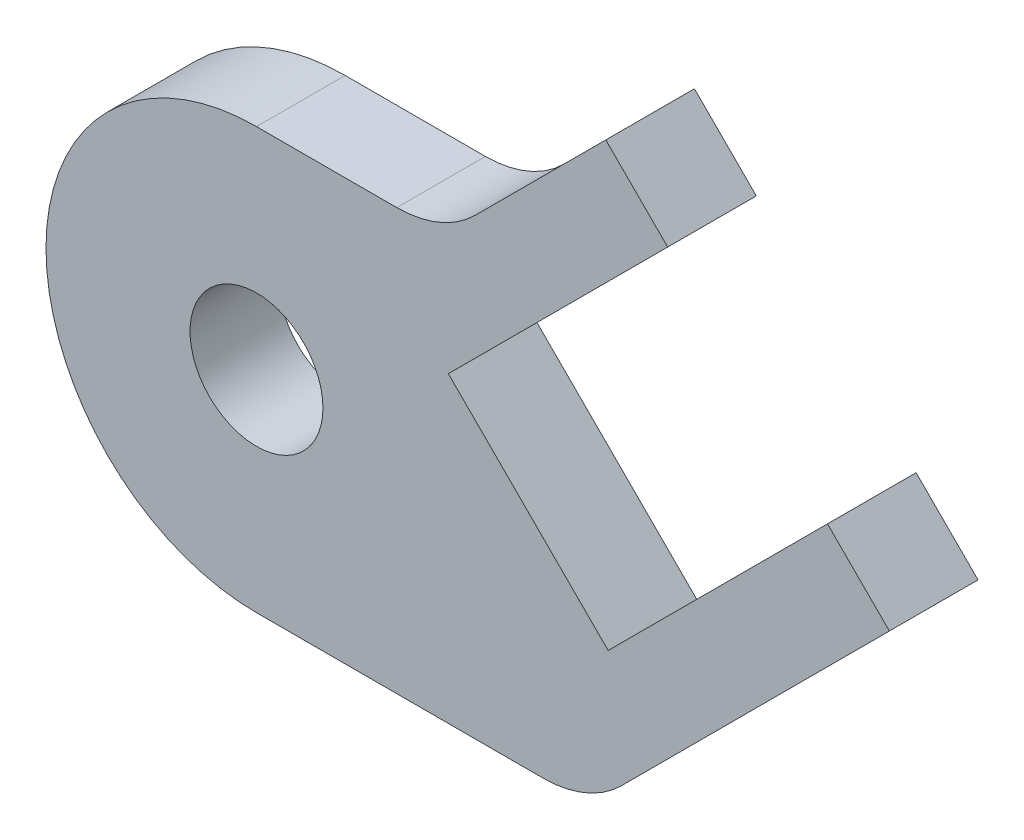
from build123d import *

# Parameters (mm, degrees)
SKETCH1_R           = 2.5
BOSS_EXTRUDE1_DEPTH = 8
SKETCH2_R           = 1.5
CUT_EXTRUDE1_DEPTH  = 77.487541414
FILLET1_R           = 10
SKETCH3_R           = 6
CUT_EXTRUDE2_DEPTH  = 77.487541414


with BuildPart() as part:
    # Sketch1 → Boss-Extrude1 (new body)
    with BuildSketch(Plane.XY):
        with BuildLine():
            Line((0, -19), (30, -19))
            Line((30, -19), (64.201367261, 15.201367261))
            Line((64.201367261, 15.201367261), (58.615223689, 20.787510832))
            Line((58.615223689, 20.787510832), (31.745166004, -6.082546853))
            Line((31.745166004, -6.082546853), (17.320187668, 8.342431483))
            Line((17.320187668, 8.342431483), (44.190245353, 35.212489168))
            Line((44.190245353, 35.212489168), (38.604101782, 40.798632739))
            Line((38.604101782, 40.798632739), (16.805469042, 19))
            Line((16.805469042, 19), (0, 19))
            ThreePointArc((0, 19), (-19, 0), (0, -19))
        make_face()
        Circle(SKETCH1_R, mode=Mode.SUBTRACT)
    extrude(amount=BOSS_EXTRUDE1_DEPTH)

    # Sketch2 → Cut-Extrude1 (cut, through all)
    with BuildSketch(Plane.XY.offset(8)):
        with Locations((38.878105659, 35.574881393)):
            Circle(SKETCH2_R)
        with Locations((58.977615915, 15.475371138)):
            Circle(SKETCH2_R)
    extrude(amount=-CUT_EXTRUDE1_DEPTH, mode=Mode.SUBTRACT)

    # Fillet1
    fillet1_edges = [part.edges().sort_by_distance(p)[0] for p in [
        (16.805469042, 19, 4),
        (30, -19, 4),
    ]]
    fillet(fillet1_edges, radius=FILLET1_R)

    # Sketch3 → Cut-Extrude2 (cut, through all)
    with BuildSketch(Plane.XY.offset(8)):
        Circle(SKETCH3_R)
        Polygon((38.604101782, 40.798632739), (64.201367261, 15.201367261), (57.130299449, 8.130299449), (31.53303397, 33.727564928), align=None)
    extrude(amount=-CUT_EXTRUDE2_DEPTH, mode=Mode.SUBTRACT)


solid = part.part
